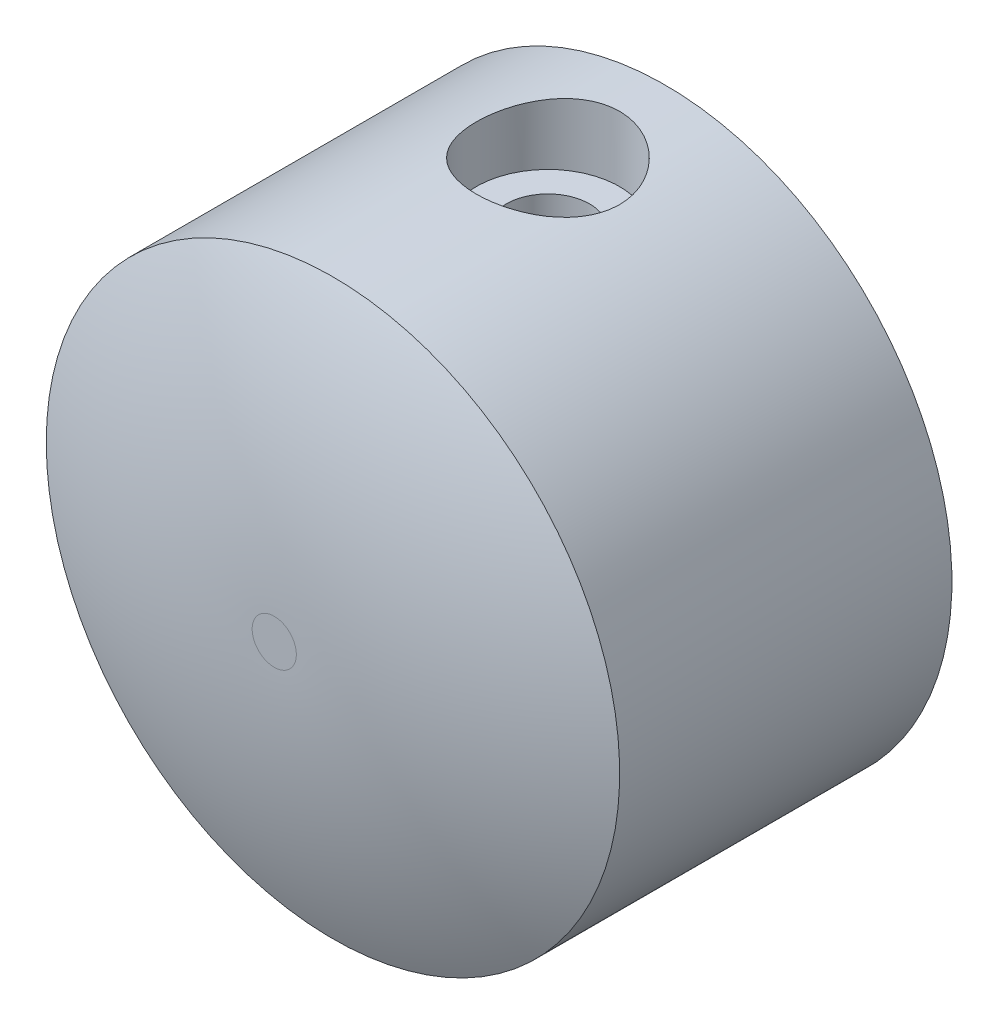
from build123d import *

# Parameters (mm, degrees)
CUT_EXTRUDE1_DEPTH      = 19.493242128
CUT_EXTRUDE1_DEPTH_BACK = 19.493242128
SKETCH2_R               = 1.6
CUT_EXTRUDE2_START      = 15
SKETCH3_R               = 2.75
CUT_EXTRUDE2_DEPTH      = 6.5
CUT_EXTRUDE3_DEPTH      = 11.5


with BuildPart() as part:
    # Sketch1 → Revolve1 (revolve)
    with BuildSketch(Plane(origin=(0, 0, 0), x_dir=(1, 0, 0), z_dir=(0, 1, 0))):
        with BuildLine():
            Line((0, 0), (6, 0))
            Line((6, 0), (6, 10))
            Line((6, 10), (11, 10))
            Line((11, 10), (11, -2.746887587))
            ThreePointArc((11, -2.746887587), (6.047263602, -4.429952007), (0.847518516, -5))
            Line((0.847518516, -5), (0, -5))
            Line((0, -5), (0, 0))
        make_face()
    revolve(axis=Axis((0, 0, 0), (0, 0, 1)))

    # Sketch2 → Cut-Extrude1 (cut, two sides: drawn at the far end of the back side and taken through both)
    with BuildSketch(Plane(origin=(0, 0, 0), x_dir=(1, 0, 0), z_dir=(0, 1, 0)).offset(-CUT_EXTRUDE1_DEPTH_BACK)):
        with Locations((0, 5.5)):
            Circle(SKETCH2_R)
    extrude(amount=CUT_EXTRUDE1_DEPTH + CUT_EXTRUDE1_DEPTH_BACK, mode=Mode.SUBTRACT)

    # Sketch3 → Cut-Extrude2 (cut)
    with BuildSketch(Plane(origin=(0, 0, 0), x_dir=(1, 0, 0), z_dir=(0, 1, 0)).offset(CUT_EXTRUDE2_START)):
        with Locations((0, 5.5)):
            Circle(SKETCH3_R)
    extrude(amount=-CUT_EXTRUDE2_DEPTH, mode=Mode.SUBTRACT)

    # Sketch4 → Cut-Extrude3 (cut)
    with BuildSketch(Plane(origin=(0, -20, 0), x_dir=(1, 0, 0), z_dir=(0, 1, 0))):
        Polygon((1.645448267, 2.65), (3.290896534, 5.5), (1.645448267, 8.35), (-1.645448267, 8.35), (-3.290896534, 5.5), (-1.645448267, 2.65), align=None)
    extrude(amount=CUT_EXTRUDE3_DEPTH, mode=Mode.SUBTRACT)


solid = part.part
